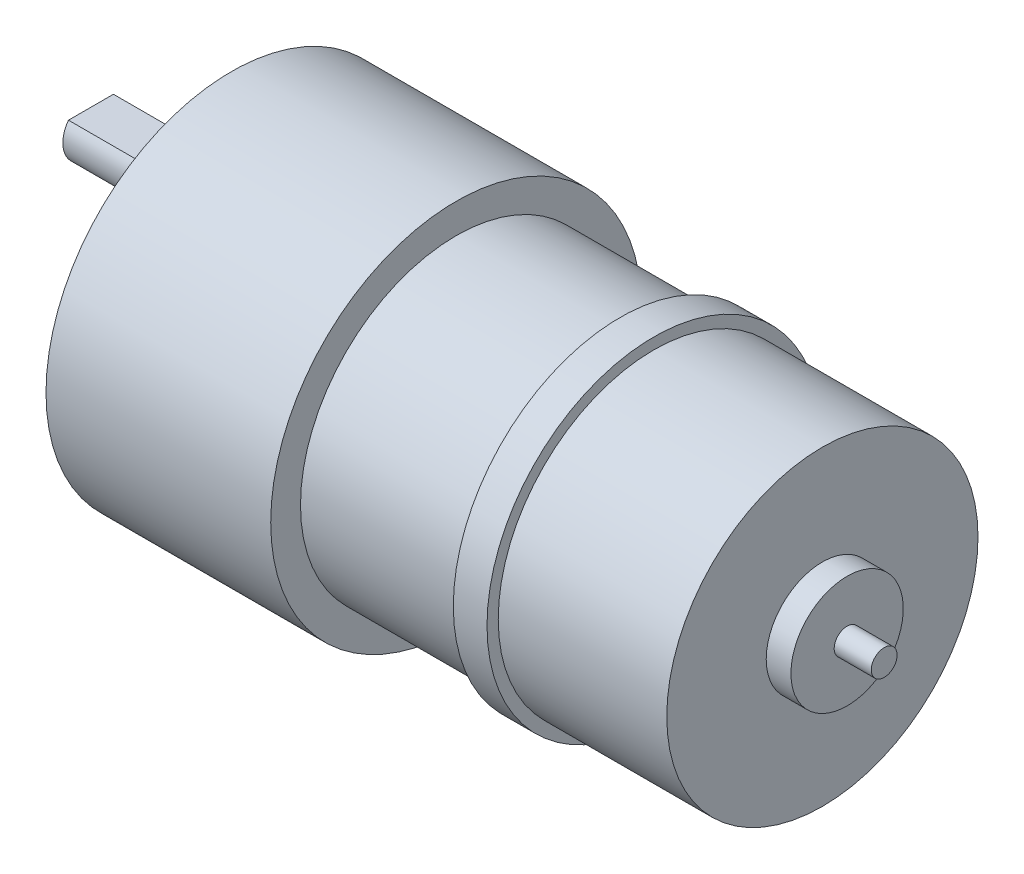
from build123d import *

# Parameters (mm, degrees)
SKETCH1_W          = 20
SKETCH1_H          = 16.5
SKETCH1_W_2        = 14.6
SKETCH1_H_2        = 13.85
SKETCH1_W_3        = 3
SKETCH1_H_3        = 1
SKETCH1_W_4        = 3.3
SKETCH1_H_4        = 1.15
SKETCH3_W          = 10.5
SKETCH3_H          = 2.5
CUT_EXTRUDE1_DEPTH = 8


with BuildPart() as part:
    # Sketch1 → Revolve1 (revolve)
    with BuildSketch(Plane.XY, mode=Mode.PRIVATE) as revolve1_sk:
        with Locations((10, 8.25)):
            Rectangle(SKETCH1_W, SKETCH1_H)
        with Locations((27.3, 6.925)):
            Rectangle(SKETCH1_W_2, SKETCH1_H_2)
        with Locations((36.1, 6.925)):
            Rectangle(SKETCH1_W_3, SKETCH1_H_2)
        with Locations((36.1, 14.35)):
            Rectangle(SKETCH1_W_3, SKETCH1_H_3)
        Polygon((37.6, 13.85), (37.6, 0), (52.6, 0), (52.6, 5), (52.6, 13.85), align=None)
        Polygon((52.6, 5), (52.6, 0), (54.8, 0), (54.8, 1.15), (54.8, 5), align=None)
        with Locations((56.45, 0.575)):
            Rectangle(SKETCH1_W_4, SKETCH1_H_4)
    revolve(revolve1_sk.sketch.rotate(Axis((0, 0, 0), (1, 0, 0)), 90), axis=Axis((0, 0, 0), (1, 0, 0)))

    # Sketch3 → Revolve2 (revolve)
    with BuildSketch(Plane.XY, mode=Mode.PRIVATE) as revolve2_sk:
        with Locations((-7.25, 7.25)):
            Rectangle(SKETCH3_W, SKETCH3_H)
        Polygon((-2, 8.5), (-2, 6), (0, 6), (0, 11), (-2, 11), align=None)
    revolve(revolve2_sk.sketch.rotate(Axis((-12.5, 6, 0), (1, 0, 0)), 90), axis=Axis((-12.5, 6, 0), (1, 0, 0)))

    # Sketch4 → Cut-Extrude1 (cut)
    with BuildSketch(Plane.ZY.offset(12.5)):
        Polygon((-72.605280298, 7.5), (-2, 7.5), (2, 7.5), (72.605280298, 7.5), (72.605280298, 148.710560596), (-72.605280298, 148.710560596), align=None)
    extrude(amount=-CUT_EXTRUDE1_DEPTH, mode=Mode.SUBTRACT)


solid = part.part
